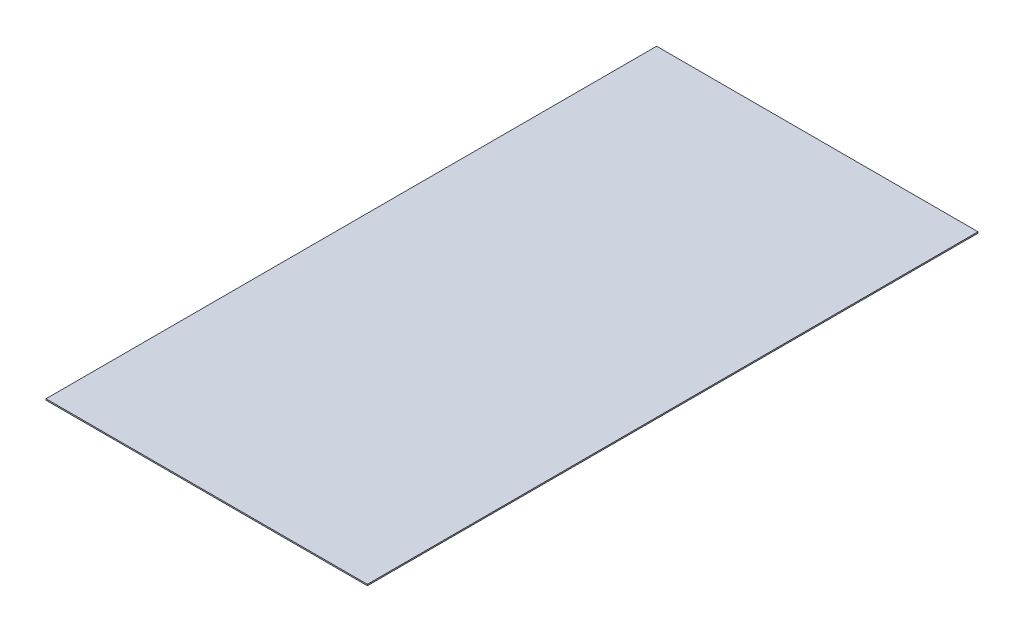
from build123d import *

# Parameters (mm, degrees)
SKETCH1_W                        = 400
SKETCH1_H                        = 760
BLANK_KARTON_E_DALGA_1_6_1_DEPTH = 1.6


with BuildPart() as part:
    # Sketch1 → BLANK_karton_E_dalga_1.6_1 (new body)
    with BuildSketch(Plane(origin=(0, 0, 0), x_dir=(1, 0, 0), z_dir=(0, 1, 0))):
        with Locations((200, 380)):
            Rectangle(SKETCH1_W, SKETCH1_H)
    extrude(amount=BLANK_KARTON_E_DALGA_1_6_1_DEPTH)


solid = part.part
